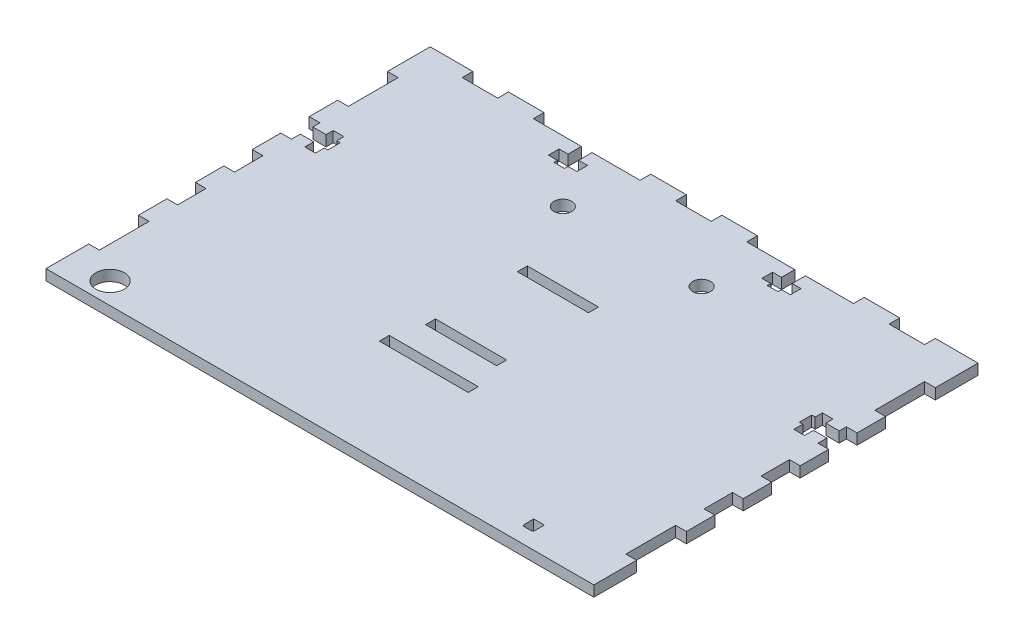
from build123d import *

# Parameters (mm, degrees)
CROQUIS1_R              = 4
SALIENTE_EXTRUIR1_DEPTH = 1.5
CROQUIS3_R              = 2.5
CROQUIS3_W              = 20
CROQUIS3_H              = 2.8
CROQUIS3_W_2            = 25
CORTAR_EXTRUIR2_DEPTH   = 3


with BuildPart() as part:
    # Croquis1 → Saliente-Extruir1 (new, symmetric)
    with BuildSketch(Plane(origin=(0, 0, 0), x_dir=(1, 0, 0), z_dir=(0, 1, 0))):
        Polygon((-77, -42), (-77, -54), (77, -54), (77, -42), (74, -42), (74, -28), (77, -28), (77, -20), (74, -20), (74, -12), (77, -12), (77, -4), (74, -4), (74, -1.5), (74, 1.5), (74, 4), (77, 4), (77, 12), (74, 12), (74, 14.497912952), (70.25, 14.497912952), (70.25, 12), (67.25, 12), (67.25, 14.497912952), (66.27, 14.497912952), (66.27, 17.992083938), (67.25, 17.992083938), (67.25, 20), (70.25, 20), (70.25, 17.992083938), (74, 17.992083938), (74, 20), (77, 20), (77, 28), (74, 28), (74, 42), (77, 42), (77, 54), (65, 54), (65, 51), (55, 51), (55, 54), (45, 54), (45, 51), (31.5, 51), (31.5, 47.25), (34, 47.25), (34, 44.25), (31.5, 44.25), (31.5, 43.27), (28.5, 43.27), (28.5, 44.25), (26, 44.25), (26, 47.25), (28.5, 47.25), (28.5, 51), (15, 51), (15, 54), (5, 54), (5, 51), (-5, 51), (-5, 54), (-15, 54), (-15, 51), (-28.5, 51), (-28.5, 47.25), (-26, 47.25), (-26, 44.25), (-28.5, 44.25), (-28.5, 43.27), (-31.5, 43.27), (-31.5, 44.25), (-34, 44.25), (-34, 47.25), (-31.5, 47.25), (-31.5, 51), (-45, 51), (-45, 54), (-55, 54), (-55, 51), (-65, 51), (-65, 54), (-77, 54), (-77, 42), (-74, 42), (-74, 28), (-77, 28), (-77, 20), (-74, 20), (-74, 17.992083938), (-70.25, 17.992083938), (-70.25, 20), (-67.25, 20), (-67.25, 17.992083938), (-66.27, 17.992083938), (-66.27, 14.497912952), (-67.25, 14.497912952), (-67.25, 12), (-70.25, 12), (-70.25, 14.497912952), (-74, 14.497912952), (-74, 12), (-77, 12), (-77, 4), (-74, 4), (-74, 1.5), (-74, -1.5), (-74, -4), (-77, -4), (-77, -12), (-74, -12), (-74, -20), (-77, -20), (-77, -28), (-74, -28), (-74, -42), align=None)
        with Locations(Location((-65, -48, 0), (0, 0, 270))):
            Circle(CROQUIS1_R, mode=Mode.SUBTRACT)
        with BuildLine():
            Line((55, -49.6), (53, -49.6))
            ThreePointArc((53, -49.6), (52.646446609, -49.453553391), (52.5, -49.1))
            Line((52.5, -49.1), (52.5, -46.4))
            Line((52.5, -46.4), (55.5, -46.4))
            Line((55.5, -46.4), (55.5, -49.1))
            ThreePointArc((55.5, -49.1), (55.353553391, -49.453553391), (55, -49.6))
        make_face(mode=Mode.SUBTRACT)
    extrude(amount=SALIENTE_EXTRUIR1_DEPTH, both=True)

    # Croquis3 → Cortar-Extruir2 (cut)
    with BuildSketch(Plane(origin=(0, 1.5, 0), x_dir=(1, 0, 0), z_dir=(0, 1, 0))):
        with Locations(Location((-19.5, 33.79, 0), (0, 0, 270))):
            Circle(CROQUIS3_R)
        with Locations(Location((19.5, 33.79, 0), (0, 0, 270))):
            Circle(CROQUIS3_R)
        with Locations((0, 12.9)):
            Rectangle(CROQUIS3_W, CROQUIS3_H)
        with Locations((0, -12.9)):
            Rectangle(CROQUIS3_W, CROQUIS3_H)
        with Locations((0, -23.4)):
            Rectangle(CROQUIS3_W_2, CROQUIS3_H)
    extrude(amount=-CORTAR_EXTRUIR2_DEPTH, mode=Mode.SUBTRACT)


solid = part.part
